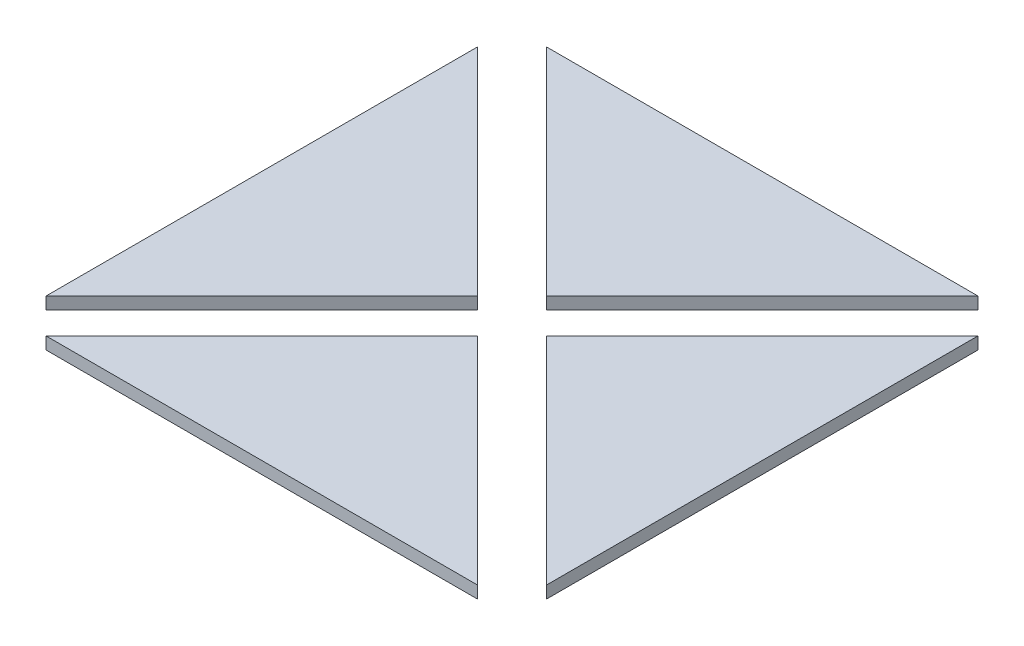
from build123d import *

# Parameters (mm, degrees)
BOSS_EXTRUDE1_DEPTH   = 10
BOSS_EXTRUDE1_2_DEPTH = 10
BOSS_EXTRUDE1_3_DEPTH = 10
BOSS_EXTRUDE1_4_DEPTH = 10


with BuildPart() as part:
    # Sketch1 → Boss-Extrude1 (new body)
    with BuildSketch(Plane(origin=(0, 0, 0), x_dir=(1, 0, 0), z_dir=(0, 1, 0))):
        Polygon((-205, 176.715728753), (-205, -176.715728753), (-28.284271247, 0), align=None)
    extrude(amount=BOSS_EXTRUDE1_DEPTH)


with BuildPart() as body_2:
    # Sketch1 → Boss-Extrude1 2 (new body)
    with BuildSketch(Plane(origin=(0, 0, 0), x_dir=(1, 0, 0), z_dir=(0, 1, 0))):
        Polygon((-176.715728753, 205), (0, 28.284271247), (176.715728753, 205), align=None)
    extrude(amount=BOSS_EXTRUDE1_2_DEPTH)


with BuildPart() as body_3:
    # Sketch1 → Boss-Extrude1 3 (new body)
    with BuildSketch(Plane(origin=(0, 0, 0), x_dir=(1, 0, 0), z_dir=(0, 1, 0))):
        Polygon((205, 176.715728753), (28.284271247, 0), (205, -176.715728753), align=None)
    extrude(amount=BOSS_EXTRUDE1_3_DEPTH)


with BuildPart() as body_4:
    # Sketch1 → Boss-Extrude1 4 (new body)
    with BuildSketch(Plane(origin=(0, 0, 0), x_dir=(1, 0, 0), z_dir=(0, 1, 0))):
        Polygon((176.715728753, -205), (0, -28.284271247), (-176.715728753, -205), align=None)
    extrude(amount=BOSS_EXTRUDE1_4_DEPTH)


solid = Compound([part.part, body_2.part, body_3.part, body_4.part])
